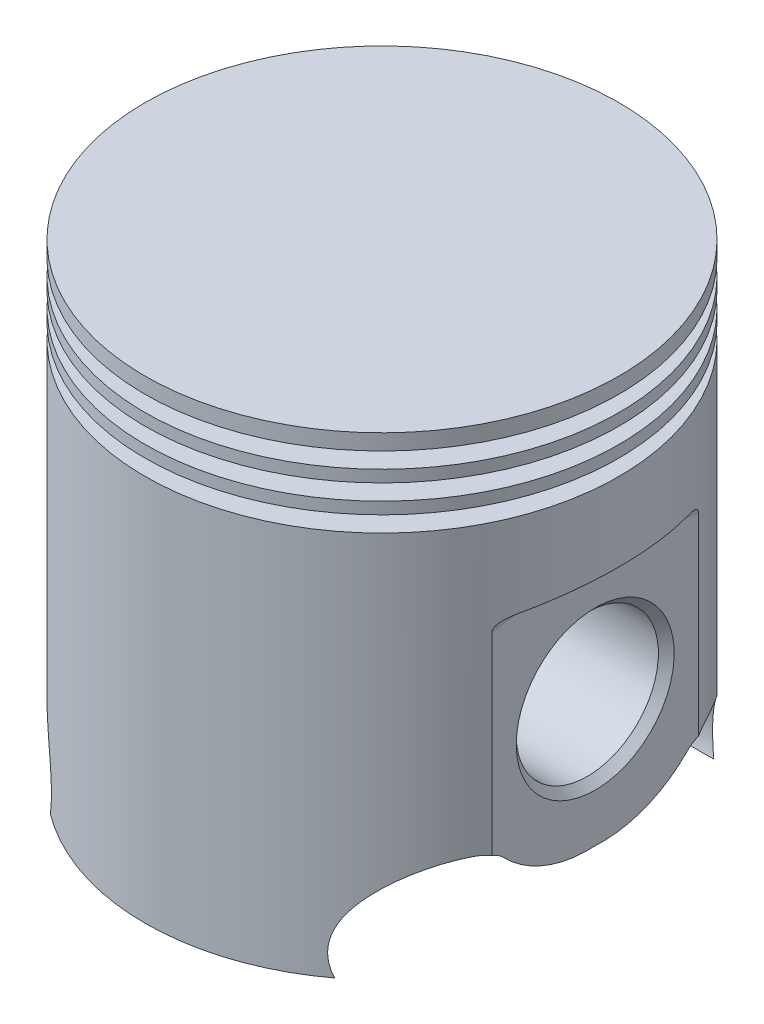
from build123d import *

# Parameters (mm, degrees)
BOSS_EXTRUDE1_REACH      = 80.102
BOSS_EXTRUDE1_END_RADIUS = 22.02
SKETCH2_R                = 12.5
SKETCH3_R                = 9
CUT_EXTRUDE1_DEPTH       = 79.102496759
CUT_EXTRUDE2_DEPTH       = 3.01
CHAMFER1_SIZE            = 1
CUT_EXTRUDE3_DEPTH       = 91.006667075
CHAMFER1_OF_MIRROR1_SIZE = 1
FILLET2_R                = 1


with BuildPart() as part:
    # Sketch1 → Revolve1 (revolve)
    with BuildSketch(Plane.XY, mode=Mode.PRIVATE) as revolve1_sk:
        Polygon((25.5, 0), (30, 0), (30, 49), (25.52, 49), (25.52, 51), (30, 51), (30, 52.5), (25.52, 52.5), (25.52, 54.5), (30, 54.5), (30, 56), (25.52, 56), (25.52, 58), (30, 58), (30, 60), (0, 60), (0, 51), (22.02, 51), (22.02, 21.56), (20.02, 19.881800738), (20.02, 10.598265979), (25.5, 6), align=None)
    revolve(revolve1_sk.sketch.rotate(Axis((0, 60, 0), (0, -1, 0)), 180), axis=Axis((0, 60, 0), (0, -1, 0)))

    # Boss-Extrude1: up to this cylinder (the profile starts inside it)
    boss_extrude1_end = Plane(origin=(0, 23.1, 0), z_dir=(0, 1, 0)) * Cylinder(BOSS_EXTRUDE1_END_RADIUS, 205.244, mode=Mode.PRIVATE)
    # Sketch2 → Boss-Extrude1 (add, up to the surface)
    with BuildSketch(Plane(origin=(10, 0, 0), x_dir=(0, 0, -1), z_dir=(1, 0, 0)), mode=Mode.PRIVATE) as boss_extrude1_sk1:
        with Locations(Location((0, 23.1, 0), (0, 0, 187.07683119))):
            Circle(SKETCH2_R)
    boss_extrude1_tool1 = extrude(boss_extrude1_sk1.sketch, amount=BOSS_EXTRUDE1_REACH, mode=Mode.PRIVATE) & boss_extrude1_end
    boss_extrude1 = boss_extrude1_tool1.solids().sort_by_distance((10, 23.1, 0))[0]
    add(boss_extrude1)

    # Sketch3 → Cut-Extrude1 (cut, through all)
    with BuildSketch(Plane.ZY.offset(-10)):
        with Locations((0, 23.1)):
            Circle(SKETCH3_R)
    cut_extrude1 = extrude(amount=-CUT_EXTRUDE1_DEPTH, mode=Mode.SUBTRACT)

    # Sketch4 → Cut-Extrude2 (cut)
    with BuildSketch(Plane(origin=(30.01, 0, 0), x_dir=(0, 0, -1), z_dir=(1, 0, 0))):
        with BuildLine():
            Line((-13.075, 0), (13.075, 0))
            Line((13.075, 0), (13.075, 38))
            ThreePointArc((13.075, 38), (0, 39.075704786), (-13.075, 38))
            Line((-13.075, 38), (-13.075, 0))
        make_face()
    cut_extrude2 = extrude(amount=-CUT_EXTRUDE2_DEPTH, mode=Mode.SUBTRACT)

    # Chamfer1
    chamfer1_edges = [part.edges().sort_by_distance(p)[0] for p in [
        (27, 23.1, -9),
    ]]
    chamfer(chamfer1_edges, length=CHAMFER1_SIZE)

    # Sketch14 → Cut-Extrude3 (cut, through all)
    with BuildSketch(Plane(origin=(30.01, 0, 0), x_dir=(0, 0, -1), z_dir=(1, 0, 0))):
        with BuildLine():
            Line((-24, 0), (24, 0))
            ThreePointArc((24, 0), (22.404028585, 8.683291996), (14.55551627, 12.726501006))
            ThreePointArc((14.55551627, 12.726501006), (12.958291901, 12.42672358), (11.612141714, 11.516299578))
            ThreePointArc((11.612141714, 11.516299578), (6.297172835, 7.995446626), (0, 7))
            ThreePointArc((0, 7), (-6.297172835, 7.995446626), (-11.612141714, 11.516299578))
            ThreePointArc((-11.612141714, 11.516299578), (-12.958291901, 12.42672358), (-14.55551627, 12.726501006))
            ThreePointArc((-14.55551627, 12.726501006), (-22.404028585, 8.683291996), (-24, 0))
        make_face()
    extrude(amount=-CUT_EXTRUDE3_DEPTH, mode=Mode.SUBTRACT)

    # Mirror1: Boss-Extrude1, Cut-Extrude1, Cut-Extrude2 across plane
    add(boss_extrude1.mirror(Plane(origin=(0, 0, 0), x_dir=(0, 0, 1), z_dir=(1, 0, 0))))
    add(cut_extrude1.mirror(Plane(origin=(0, 0, 0), x_dir=(0, 0, 1), z_dir=(1, 0, 0))), mode=Mode.SUBTRACT)
    add(cut_extrude2.mirror(Plane(origin=(0, 0, 0), x_dir=(0, 0, 1), z_dir=(1, 0, 0))), mode=Mode.SUBTRACT)

    # Chamfer1 of Mirror1
    chamfer1_of_mirror1_edges = [part.edges().sort_by_distance(p)[0] for p in [
        (-27, 23.1, -9),
    ]]
    chamfer(chamfer1_of_mirror1_edges, length=CHAMFER1_OF_MIRROR1_SIZE)

    # Fillet2
    fillet2_edges = [part.edges().sort_by_distance(p)[0] for p in [
        (27, 39.075704786, 0),
        (-27, 39.075704786, 0),
    ]]
    fillet(fillet2_edges, radius=FILLET2_R)


solid = part.part
